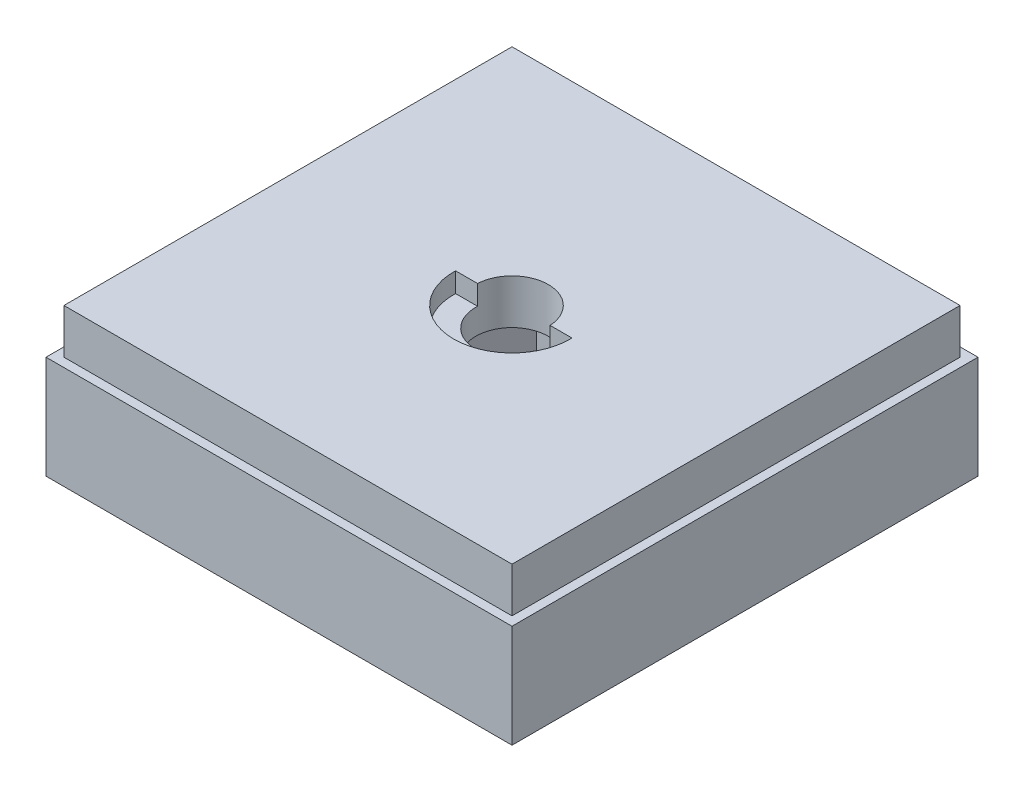
from build123d import *

# Parameters (mm, degrees)
SKETCH1_W           = 52
SKETCH1_H           = 52
BOSS_EXTRUDE1_DEPTH = 11.5
SKETCH2_W           = 50
SKETCH2_H           = 50
SKETCH2_R           = 4.05
BOSS_EXTRUDE2_DEPTH = 5
SKETCH3_R           = 8
CUT_EXTRUDE1_DEPTH  = 7
CUT_EXTRUDE2_DEPTH  = 2.2


with BuildPart() as part:
    # Sketch1 → Boss-Extrude1 (new body)
    with BuildSketch(Plane(origin=(0, 0, 0), x_dir=(1, 0, 0), z_dir=(0, 1, 0))):
        with Locations((-26, 26)):
            Rectangle(SKETCH1_W, SKETCH1_H)
        Polygon((-18.494446501, 26), (-22.24722325, 32.5), (-29.75277675, 32.5), (-33.505553499, 26), (-29.75277675, 19.5), (-22.24722325, 19.5), align=None, mode=Mode.SUBTRACT)
    extrude(amount=BOSS_EXTRUDE1_DEPTH)

    # Sketch2 → Boss-Extrude2 (add)
    with BuildSketch(Plane(origin=(0, 11.5, 0), x_dir=(1, 0, 0), z_dir=(0, 1, 0))):
        with Locations((-26, 26)):
            Rectangle(SKETCH2_W, SKETCH2_H)
        with Locations(Location((-26, 26, 0), (0, 0, 270))):
            Circle(SKETCH2_R, mode=Mode.SUBTRACT)
    extrude(amount=BOSS_EXTRUDE2_DEPTH)

    # Sketch3 → Cut-Extrude1 (cut)
    with BuildSketch(Plane.XZ):
        with Locations(Location((-26, -26, 0), (0, 0, 270))):
            Circle(SKETCH3_R)
    extrude(amount=-CUT_EXTRUDE1_DEPTH, mode=Mode.SUBTRACT)

    # Sketch4 → Cut-Extrude2 (cut)
    with BuildSketch(Plane(origin=(0, 16.5, 0), x_dir=(1, 0, 0), z_dir=(0, 1, 0))):
        with BuildLine():
            Line((-32.496922348, 26.2), (-19.503077652, 26.2))
            ThreePointArc((-19.503077652, 26.2), (-26, 19.5), (-32.496922348, 26.2))
        make_face()
    extrude(amount=-CUT_EXTRUDE2_DEPTH, mode=Mode.SUBTRACT)


solid = part.part
